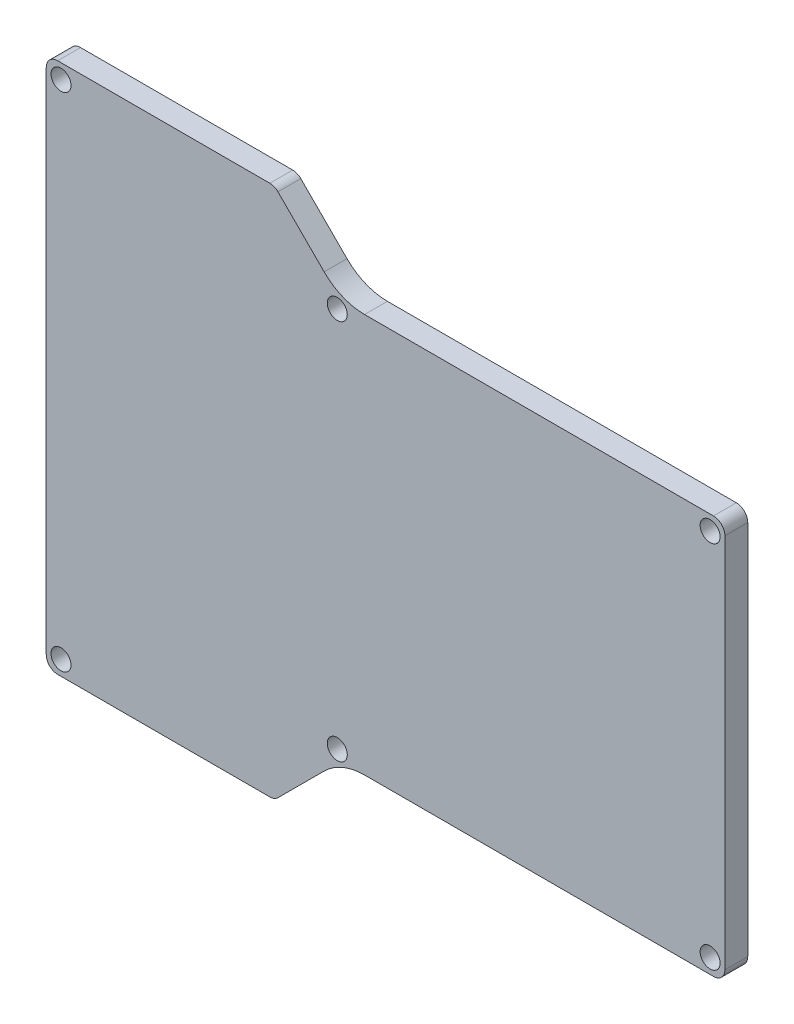
from build123d import *

# Parameters (mm, degrees)
SKETCH1_R           = 1.75
BOSS_EXTRUDE1_DEPTH = 4
SKETCH2_W           = 12.132955251
SKETCH2_H           = 30.105
CUT_EXTRUDE2_DEPTH  = 1


with BuildPart() as part:
    # Sketch1 → Boss-Extrude1 (new body)
    with BuildSketch(Plane.XY):
        with BuildLine():
            Line((22.242640687, -103.68381275), (30.337922061, -95.588531376))
            ThreePointArc((30.337922061, -95.588531376), (33.58215555, -93.420803863), (37.408989873, -92.659599188))
            Line((37.408989873, -92.659599188), (97.386933012, -92.659599188))
            Line((97.386933012, -92.659599188), (98.455, -92.659599188))
            ThreePointArc((98.455, -92.659599188), (99.869213562, -92.07381275), (100.455, -90.659599188))
            Line((100.455, -90.659599188), (100.455, -24.874599188))
            ThreePointArc((100.455, -24.874599188), (99.869213562, -23.460385626), (98.455, -22.874599188))
            Line((98.455, -22.874599188), (97.38733653, -22.874599188))
            Line((97.38733653, -22.874599188), (37.403989873, -22.874599188))
            ThreePointArc((37.403989873, -22.874599188), (33.57715555, -22.113394513), (30.332922061, -19.945667))
            Line((30.332922061, -19.945667), (22.242640687, -11.855385626))
            ThreePointArc((22.242640687, -11.855385626), (21.593793989, -11.421840123), (20.828427125, -11.269599188))
            Line((20.828427125, -11.269599188), (-16.3, -11.269599188))
            ThreePointArc((-16.3, -11.269599188), (-17.714213562, -11.855385626), (-18.3, -13.269599188))
            Line((-18.3, -13.269599188), (-18.3, -29.968425088))
            add(Edge.make_bspline(
                [(-18.3, -29.968425088), (-18.3, -30.568817376), (-18.296844416, -31.1692069), (-18.296844416, -31.769599188), (-18.296844416, -32.369991476), (-18.3, -32.970381), (-18.3, -33.570773288)],
                knots=[0, 0, 0, 0, 0.001801177, 0.001801177, 0.001801177, 0.003602354, 0.003602354, 0.003602354, 0.003602354], degree=3))
            Line((-18.3, -33.570773288), (-18.3, -55.968425088))
            add(Edge.make_bspline(
                [(-18.3, -55.968425088), (-18.3, -56.568817376), (-18.296844416, -57.1692069), (-18.296844416, -57.769599188), (-18.296844416, -58.369991476), (-18.3, -58.970381), (-18.3, -59.570773288)],
                knots=[0, 0, 0, 0, 0.001801177, 0.001801177, 0.001801177, 0.003602354, 0.003602354, 0.003602354, 0.003602354], degree=3))
            Line((-18.3, -59.570773288), (-18.3, -81.968425088))
            add(Edge.make_bspline(
                [(-18.3, -81.968425088), (-18.3, -82.568817376), (-18.296844416, -83.1692069), (-18.296844416, -83.769599188), (-18.296844416, -84.369991476), (-18.3, -84.970381), (-18.3, -85.570773288)],
                knots=[0, 0, 0, 0, 0.001801177, 0.001801177, 0.001801177, 0.003602354, 0.003602354, 0.003602354, 0.003602354], degree=3))
            Line((-18.3, -85.570773288), (-18.3, -102.269599188))
            ThreePointArc((-18.3, -102.269599188), (-17.714213562, -103.68381275), (-16.3, -104.269599188))
            Line((-16.3, -104.269599188), (20.828427125, -104.269599188))
            ThreePointArc((20.828427125, -104.269599188), (21.593793989, -104.117358253), (22.242640687, -103.68381275))
        make_face()
        with Locations((-15.716636906, -101.686236094)):
            Circle(SKETCH1_R, mode=Mode.SUBTRACT)
        with Locations((-15.716636906, -13.852962283)):
            Circle(SKETCH1_R, mode=Mode.SUBTRACT)
        with Locations((32.622607905, -24.417876383)):
            Circle(SKETCH1_R, mode=Mode.SUBTRACT)
        with Locations((32.627607905, -91.116321993)):
            Circle(SKETCH1_R, mode=Mode.SUBTRACT)
        with Locations((97.869213562, -90.07381275)):
            Circle(SKETCH1_R, mode=Mode.SUBTRACT)
        with Locations((97.869213562, -25.460385626)):
            Circle(SKETCH1_R, mode=Mode.SUBTRACT)
    extrude(amount=BOSS_EXTRUDE1_DEPTH)

    # Sketch2 → Cut-Extrude2 (cut)
    with BuildSketch(Plane(origin=(0, 0, 0), x_dir=(-1, 0, 0), z_dir=(0, 0, -1))):
        with Locations((-74.209835266, -56.927099188)):
            Rectangle(SKETCH2_W, SKETCH2_H)
    extrude(amount=-CUT_EXTRUDE2_DEPTH, mode=Mode.SUBTRACT)


solid = part.part
